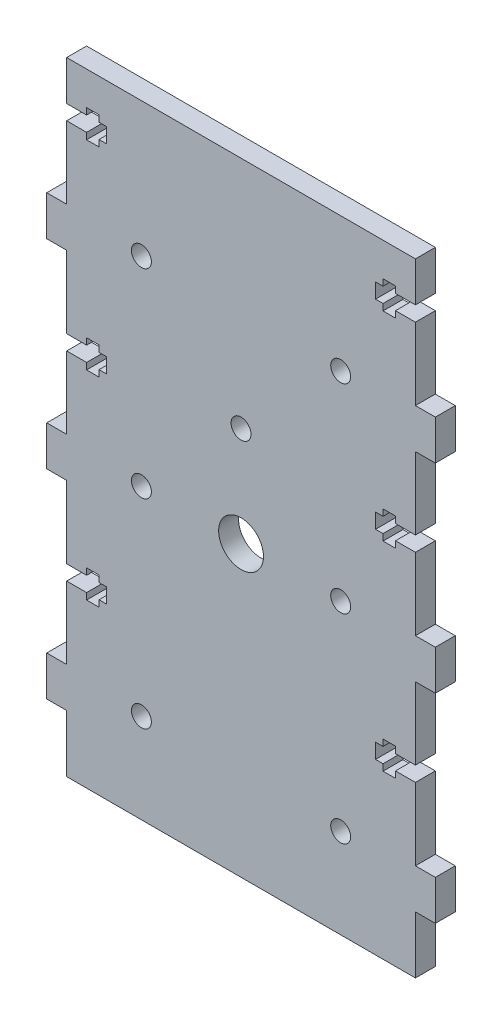
from build123d import *

# Parameters (mm, degrees)
SKETCH_1_R          = 2
SKETCH_1_R_2        = 4.5
EXTRUDE_1_DEPTH     = 4
SKETCH_4_W          = 70
SKETCH_4_H          = 12
CUT_EXTRUDE_1_DEPTH = 4


with BuildPart() as part:
    # 草图1 → 凸台-拉伸1 (new body)
    with BuildSketch(Plane.XY):
        Polygon((35, 50), (-35, 50), (-35, 41.99755337), (-31, 41.99755337), (-31, 43.29755337), (-28.5, 43.29755337), (-28.5, 41.99755337), (-27, 41.99755337), (-27, 38.99755337), (-28.5, 38.99755337), (-28.5, 37.69755337), (-31, 37.69755337), (-31, 38.99755337), (-35, 38.99755337), (-35, 24.49755337), (-39, 24.49755337), (-39, 16.49755337), (-35, 16.49755337), (-35, 1.99755337), (-31, 1.99755337), (-31, 3.29755337), (-28.5, 3.29755337), (-28.5, 1.99755337), (-27, 1.99755337), (-27, -1.00244663), (-28.5, -1.00244663), (-28.5, -2.30244663), (-31, -2.30244663), (-31, -1.00244663), (-35, -1.00244663), (-35, -15.50244663), (-39, -15.50244663), (-39, -23.50244663), (-35, -23.50244663), (-35, -38.00244663), (-31, -38.00244663), (-31, -36.70244663), (-28.5, -36.70244663), (-28.5, -38.00244663), (-27, -38.00244663), (-27, -41.00244663), (-28.5, -41.00244663), (-28.5, -42.30244663), (-31, -42.30244663), (-31, -41.00244663), (-35, -41.00244663), (-35, -55.50244663), (-39, -55.50244663), (-39, -63.50244663), (-35, -63.50244663), (-35, -87), (35, -87), (35, -63.50244663), (39, -63.50244663), (39, -55.50244663), (35, -55.50244663), (35, -41.00244663), (31, -41.00244663), (31, -42.30244663), (28.5, -42.30244663), (28.5, -41.00244663), (27, -41.00244663), (27, -38.00244663), (28.5, -38.00244663), (28.5, -36.70244663), (31, -36.70244663), (31, -38.00244663), (35, -38.00244663), (35, -23.50244663), (39, -23.50244663), (39, -15.50244663), (35, -15.50244663), (35, -1.00244663), (31, -1.00244663), (31, -2.30244663), (28.5, -2.30244663), (28.5, -1.00244663), (27, -1.00244663), (27, 1.99755337), (28.5, 1.99755337), (28.5, 3.29755337), (31, 3.29755337), (31, 1.99755337), (35, 1.99755337), (35, 16.49755337), (39, 16.49755337), (39, 24.49755337), (35, 24.49755337), (35, 38.99755337), (31, 38.99755337), (31, 37.69755337), (28.5, 37.69755337), (28.5, 38.99755337), (27, 38.99755337), (27, 41.99755337), (28.5, 41.99755337), (28.5, 43.29755337), (31, 43.29755337), (31, 41.99755337), (35, 41.99755337), align=None)
        with Locations((-20, -57)):
            Circle(SKETCH_1_R, mode=Mode.SUBTRACT)
        with Locations((20, -57)):
            Circle(SKETCH_1_R, mode=Mode.SUBTRACT)
        with Locations((-20, -17)):
            Circle(SKETCH_1_R, mode=Mode.SUBTRACT)
        with Locations((0, 3)):
            Circle(SKETCH_1_R, mode=Mode.SUBTRACT)
        with Locations((-20, 23)):
            Circle(SKETCH_1_R, mode=Mode.SUBTRACT)
        with Locations((0, -17)):
            Circle(SKETCH_1_R_2, mode=Mode.SUBTRACT)
        with Locations((20, -17)):
            Circle(SKETCH_1_R, mode=Mode.SUBTRACT)
        with Locations((20, 23)):
            Circle(SKETCH_1_R, mode=Mode.SUBTRACT)
    extrude(amount=EXTRUDE_1_DEPTH)

    # 草图4 → 切除-拉伸1 (cut)
    with BuildSketch(Plane.XY.offset(4)):
        with Locations((0, -81)):
            Rectangle(SKETCH_4_W, SKETCH_4_H)
    extrude(amount=-CUT_EXTRUDE_1_DEPTH, mode=Mode.SUBTRACT)


solid = part.part
